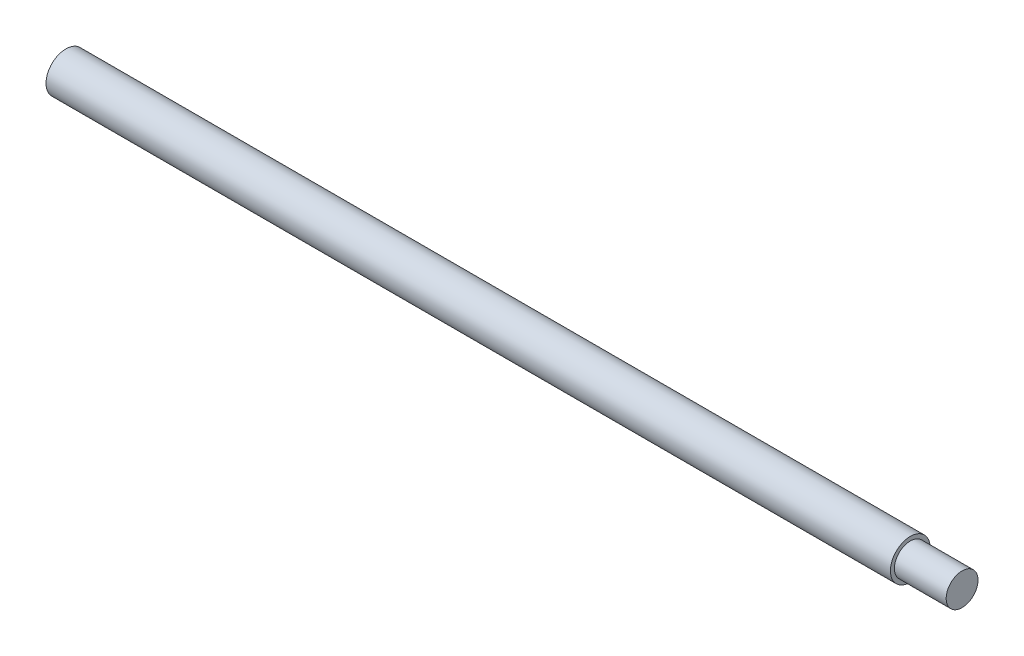
from build123d import *

# Parameters (mm, degrees)
CUT_EXTRUDE1_START = -14
SKETCH2_R          = 2
CUT_EXTRUDE1_DEPTH = 14


with BuildPart() as part:
    # Sketch1 → Revolve1 (revolve)
    with BuildSketch(Plane.XY, mode=Mode.PRIVATE) as revolve1_sk:
        Polygon((0, 0), (0, 2.5), (106, 2.5), (106, 2), (112.5, 2), (112.5, 0), align=None)
    revolve(revolve1_sk.sketch.rotate(Axis((0, 0, 0), (1, 0, 0)), 90), axis=Axis((0, 0, 0), (1, 0, 0)))

    # Sketch2 → Cut-Extrude1 (cut)
    with BuildSketch(Plane.ZY.offset(CUT_EXTRUDE1_START)):
        Circle(SKETCH2_R)
    extrude(amount=CUT_EXTRUDE1_DEPTH, mode=Mode.SUBTRACT)


solid = part.part
